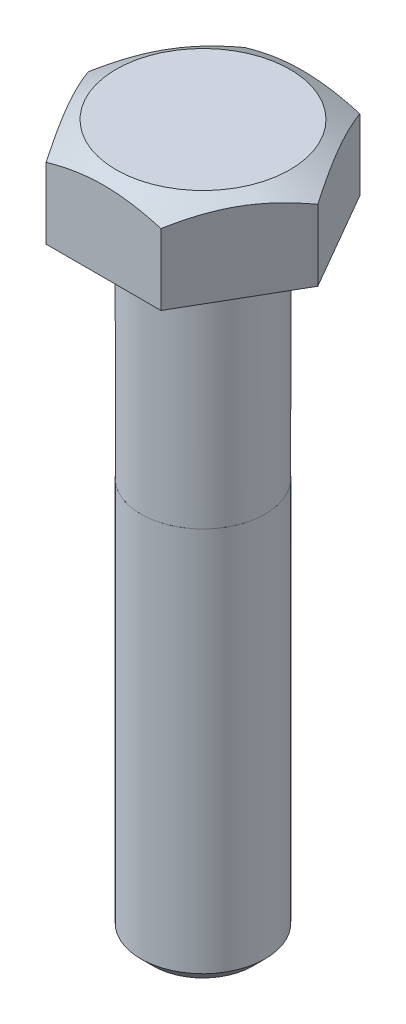
from build123d import *

# Parameters (mm, degrees)
BOSS_EXTRUDE1_DEPTH          = 3.5
SKETCH2_OUTSIDE_W            = 41.638
SKETCH2_OUTSIDE_H            = 40.4
SKETCH2_OUTSIDE_R            = 3.5
CUT_EXTRUDE1_DEPTH           = 8.041543391
CUT_EXTRUDE1_TAPER           = 60
CUT_EXTRUDE1_OTHER_WAY_DEPTH = 8.041543391
SKETCH3_R                    = 2.5
BOSS_EXTRUDE2_DEPTH          = 9
SKETCH4_R                    = 2.5
BOSS_EXTRUDE3_DEPTH          = 16
CHAMFER1_SIZE                = 0.5


with BuildPart() as part:
    # Sketch1 → Boss-Extrude1 (new body)
    with BuildSketch(Plane(origin=(0, 0, 0), x_dir=(1, 0, 0), z_dir=(0, 1, 0))):
        Polygon((-4.618802154, 0), (-2.309401077, -4), (2.309401077, -4), (4.618802154, 0), (2.309401077, 4), (-2.309401077, 4), align=None)
    extrude(amount=-BOSS_EXTRUDE1_DEPTH)

    # Sketch2 outside → Cut-Extrude1 (cut)
    with BuildSketch(Plane(origin=(0, 0, 0), x_dir=(1, 0, 0), z_dir=(0, 1, 0))):
        Rectangle(SKETCH2_OUTSIDE_W, SKETCH2_OUTSIDE_H)
        Circle(SKETCH2_OUTSIDE_R, mode=Mode.SUBTRACT)
    extrude(amount=-CUT_EXTRUDE1_DEPTH, taper=CUT_EXTRUDE1_TAPER, mode=Mode.SUBTRACT)

    # Sketch2 outside → Cut-Extrude1 other way (cut)
    with BuildSketch(Plane(origin=(0, 0, 0), x_dir=(1, 0, 0), z_dir=(0, 1, 0))):
        Rectangle(SKETCH2_OUTSIDE_W, SKETCH2_OUTSIDE_H)
        Circle(SKETCH2_OUTSIDE_R, mode=Mode.SUBTRACT)
    extrude(amount=CUT_EXTRUDE1_OTHER_WAY_DEPTH, mode=Mode.SUBTRACT)

    # Sketch3 → Boss-Extrude2 (add)
    with BuildSketch(Plane.XZ.offset(3.5)):
        with Locations(Location((0, 0, 0), (0, 0, 90))):
            Circle(SKETCH3_R)
    extrude(amount=BOSS_EXTRUDE2_DEPTH)


with BuildPart() as body_2:
    # Sketch4 → Boss-Extrude3 (new body)
    with BuildSketch(Plane.XZ.offset(12.5)):
        with Locations(Location((0, 0, 0), (0, 0, 270))):
            Circle(SKETCH4_R)
    extrude(amount=BOSS_EXTRUDE3_DEPTH)

    # Chamfer1
    chamfer1_edges = [body_2.edges().sort_by_distance(p)[0] for p in [
        (0, -28.5, 2.5),
    ]]
    chamfer(chamfer1_edges, length=CHAMFER1_SIZE)


solid = Compound([part.part, body_2.part])
